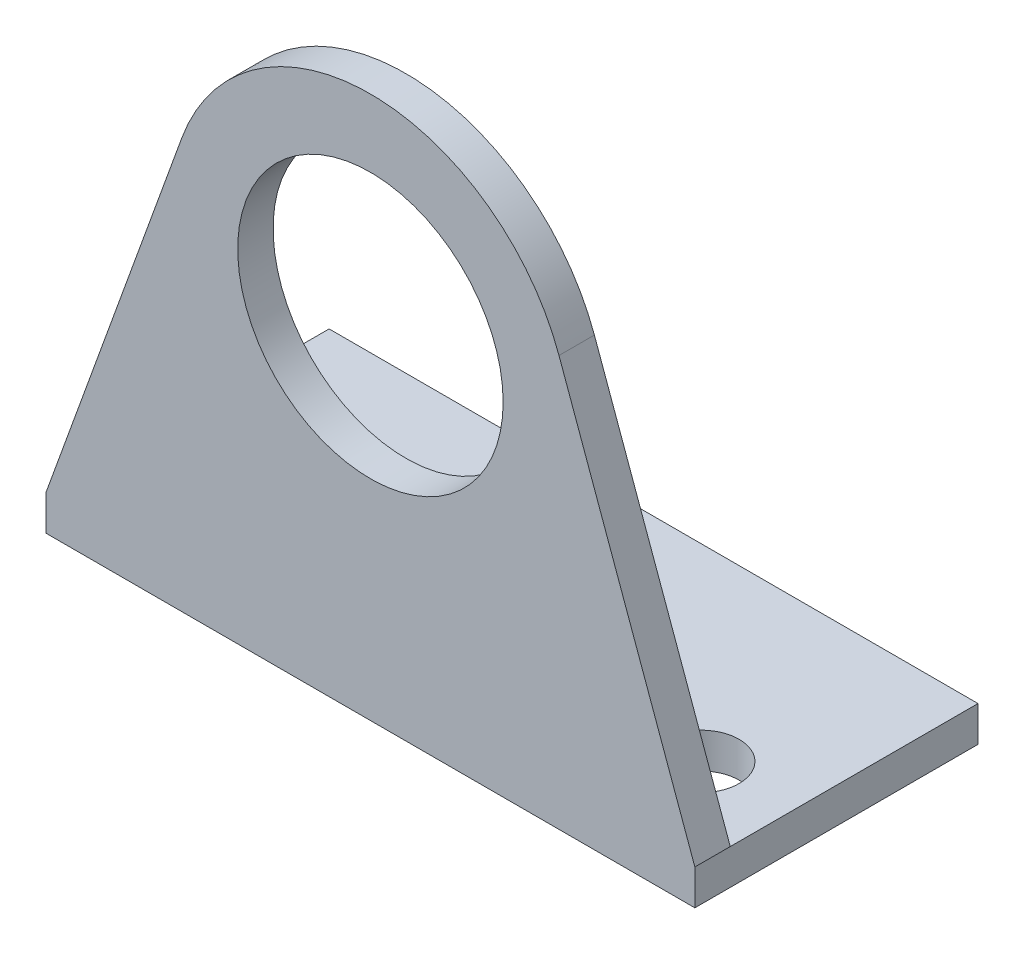
from build123d import *

# Parameters (mm, degrees)
SKETCH_1_W      = 55
SKETCH_1_H      = 24
SKETCH_1_R      = 3.25
EXTRUDE_1_DEPTH = 3
SKETCH_3_R      = 11.25
EXTRUDE_2_DEPTH = 3


with BuildPart() as part:
    # 草图1 → 凸台-拉伸1 (new body)
    with BuildSketch(Plane(origin=(0, 0, 0), x_dir=(1, 0, 0), z_dir=(0, 1, 0))):
        with Locations((27.5, 12)):
            Rectangle(SKETCH_1_W, SKETCH_1_H)
        with Locations(Location((47.5, 8, 0), (0, 0, 270))):
            Circle(SKETCH_1_R, mode=Mode.SUBTRACT)
        with Locations(Location((7.5, 8, 0), (0, 0, 270))):
            Circle(SKETCH_1_R, mode=Mode.SUBTRACT)
    extrude(amount=EXTRUDE_1_DEPTH)

    # 草图3 → 凸台-拉伸2 (add)
    with BuildSketch(Plane.XY):
        with BuildLine():
            Line((0, 3), (11.516480911, 34.790260575))
            ThreePointArc((11.516480911, 34.790260575), (27.5, 46), (43.483519089, 34.790260575))
            Line((43.483519089, 34.790260575), (55, 3))
            Line((55, 3), (0, 3))
        make_face()
        with Locations((27.5, 29)):
            Circle(SKETCH_3_R, mode=Mode.SUBTRACT)
    extrude(amount=-EXTRUDE_2_DEPTH)


solid = part.part
